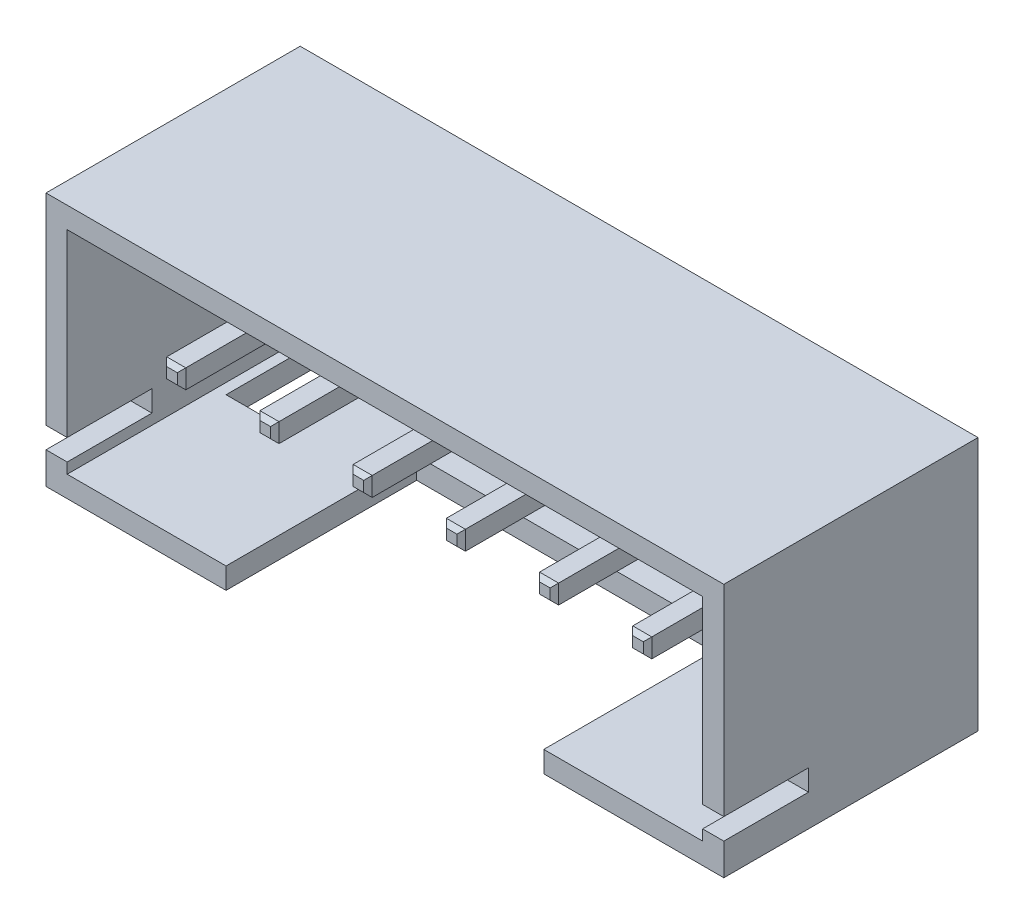
from build123d import *

# Parameters (mm, degrees)
SZKIC1_W                          = 16
SZKIC1_H                          = 6
DODANIE_WYCI_GNI_CIE1_DEPTH       = 6
SZKIC2_W                          = 15
SZKIC2_H                          = 5
WYTNIJ_WYCI_GNI_CIE1_DEPTH        = 5.5
SZKIC3_W                          = 2
SZKIC3_H                          = 0.5
WYTNIJ_WYCI_GNI_CIE2_DEPTH        = 18.349351573
WYTNIJ_WYCI_GNI_CIE3_REACH        = 13.662
SZKIC4_W                          = 7.5
SZKIC4_H                          = 4.5
WYTNIJ_WYCI_GNI_CIE4_REACH        = 13.662
SZKIC5_W                          = 1
SZKIC5_H                          = 2
SZKIC6_W                          = 0.45
SZKIC6_H                          = 0.45
DODANIE_WYCI_GNI_CIE2_DEPTH       = 4.75
SFAZOWANIE1_SIZE                  = 0.1
SZYK_LINIOWY1_COUNT               = 6
SZYK_LINIOWY1_PITCH               = 2.2
SFAZOWANIE1_OF_SZYK_LINIOWY1_SIZE = 0.1


with BuildPart() as part:
    # Szkic1 → Dodanie-wyciągnięcie1 (new body)
    with BuildSketch(Plane.XY):
        Rectangle(SZKIC1_W, SZKIC1_H)
    extrude(amount=DODANIE_WYCI_GNI_CIE1_DEPTH)

    # Szkic2 → Wytnij-wyciągnięcie1 (cut)
    with BuildSketch(Plane.XY.offset(6)):
        Rectangle(SZKIC2_W, SZKIC2_H)
    extrude(amount=-WYTNIJ_WYCI_GNI_CIE1_DEPTH, mode=Mode.SUBTRACT)

    # Szkic3 → Wytnij-wyciągnięcie2 (cut, through all)
    with BuildSketch(Plane(origin=(8, 0, 0), x_dir=(0, 0, -1), z_dir=(1, 0, 0))):
        with Locations((-5, -2)):
            Rectangle(SZKIC3_W, SZKIC3_H)
    extrude(amount=-WYTNIJ_WYCI_GNI_CIE2_DEPTH, mode=Mode.SUBTRACT)

    # Szkic4 → Wytnij-wyciągnięcie3 (cut, up to next)
    with BuildSketch(Plane.XZ.offset(3), mode=Mode.PRIVATE) as wytnij_wyci_gni_cie3_sk1:
        with Locations((0, 3.75)):
            Rectangle(SZKIC4_W, SZKIC4_H)
    wytnij_wyci_gni_cie3_tool1 = extrude(wytnij_wyci_gni_cie3_sk1.sketch, amount=-WYTNIJ_WYCI_GNI_CIE3_REACH, mode=Mode.PRIVATE) & part.part
    add(wytnij_wyci_gni_cie3_tool1.solids().sort_by_distance((0, -3, 3.75))[0], mode=Mode.SUBTRACT)

    # Szkic5 → Wytnij-wyciągnięcie4 (cut, up to next)
    with BuildSketch(Plane.XZ.offset(3), mode=Mode.PRIVATE) as wytnij_wyci_gni_cie4_sk1:
        with Locations((-6.75, 1.5)):
            Rectangle(SZKIC5_W, SZKIC5_H)
    wytnij_wyci_gni_cie4_tool1 = extrude(wytnij_wyci_gni_cie4_sk1.sketch, amount=-WYTNIJ_WYCI_GNI_CIE4_REACH, mode=Mode.PRIVATE) & part.part
    # Szkic5 → Wytnij-wyciągnięcie4 (cut, up to next)
    with BuildSketch(Plane.XZ.offset(3), mode=Mode.PRIVATE) as wytnij_wyci_gni_cie4_sk2:
        with Locations((6.75, 1.5)):
            Rectangle(SZKIC5_W, SZKIC5_H)
    wytnij_wyci_gni_cie4_tool2 = extrude(wytnij_wyci_gni_cie4_sk2.sketch, amount=-WYTNIJ_WYCI_GNI_CIE4_REACH, mode=Mode.PRIVATE) & part.part
    add(wytnij_wyci_gni_cie4_tool1.solids().sort_by_distance((-6.75, -3, 1.5))[0], mode=Mode.SUBTRACT)
    add(wytnij_wyci_gni_cie4_tool2.solids().sort_by_distance((6.75, -3, 1.5))[0], mode=Mode.SUBTRACT)

    # Szkic6 → Dodanie-wyciągnięcie2 (add)
    with BuildSketch(Plane.XY.offset(0.5)):
        with Locations((-5.775, 0)):
            Rectangle(SZKIC6_W, SZKIC6_H)
    dodanie_wyci_gni_cie2 = extrude(amount=DODANIE_WYCI_GNI_CIE2_DEPTH)

    # Sfazowanie1
    sfazowanie1_edges = [part.edges().sort_by_distance(p)[0] for p in [
        (-5.55, 0, 5.25),
        (-5.775, 0.225, 5.25),
        (-6, 0, 5.25),
        (-5.775, -0.225, 5.25),
    ]]
    chamfer(sfazowanie1_edges, length=SFAZOWANIE1_SIZE)

    # Szyk liniowy1: Dodanie-wyciągnięcie2 ×6
    with Locations(*[(i * SZYK_LINIOWY1_PITCH, 0, 0) for i in range(1, SZYK_LINIOWY1_COUNT)]):
        add(dodanie_wyci_gni_cie2)

    # Sfazowanie1 of Szyk liniowy1
    sfazowanie1_of_szyk_liniowy1_edges = [part.edges().sort_by_distance(p)[0] for p in [
        (-3.35, 0, 5.25),
        (-3.575, 0.225, 5.25),
        (-3.8, 0, 5.25),
        (-3.575, -0.225, 5.25),
        (-1.15, 0, 5.25),
        (-1.375, 0.225, 5.25),
        (-1.6, 0, 5.25),
        (-1.375, -0.225, 5.25),
        (1.05, 0, 5.25),
        (0.825, 0.225, 5.25),
        (0.6, 0, 5.25),
        (0.825, -0.225, 5.25),
        (3.25, 0, 5.25),
        (3.025, 0.225, 5.25),
        (2.8, 0, 5.25),
        (3.025, -0.225, 5.25),
        (5.45, 0, 5.25),
        (5.225, 0.225, 5.25),
        (5, 0, 5.25),
        (5.225, -0.225, 5.25),
    ]]
    chamfer(sfazowanie1_of_szyk_liniowy1_edges, length=SFAZOWANIE1_OF_SZYK_LINIOWY1_SIZE)


solid = part.part
